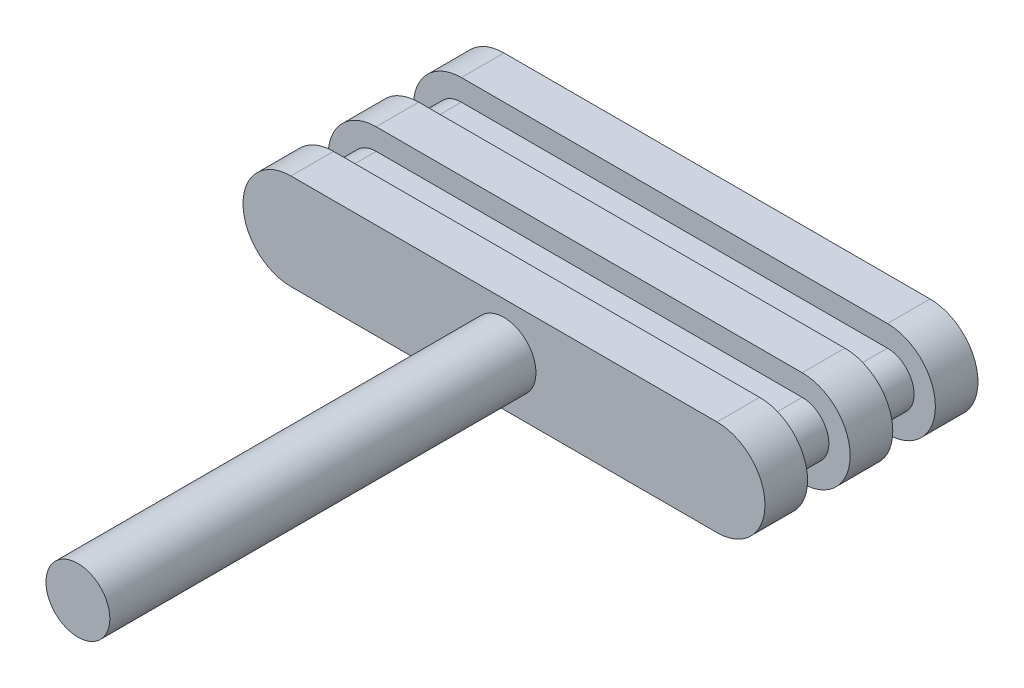
from build123d import *

# Parameters (mm, degrees)
BOSS_EXTRUDE1_DEPTH = 5
SKETCH4_R           = 1.5
BOSS_EXTRUDE3_DEPTH = 20
CUT_EXTRUDE2_START  = 2
CUT_EXTRUDE2_DEPTH  = 1
CUT_EXTRUDE4_START  = -2
CUT_EXTRUDE4_DEPTH  = 1


with BuildPart() as part:
    # Sketch1 → Boss-Extrude1 (new, symmetric)
    with BuildSketch(Plane.XY):
        with BuildLine():
            Line((10, 2.25), (-10, 2.25))
            ThreePointArc((-10, 2.25), (-12.25, 0), (-10, -2.25))
            Line((-10, -2.25), (10, -2.25))
            ThreePointArc((10, -2.25), (12.25, 0), (10, 2.25))
        make_face()
    extrude(amount=BOSS_EXTRUDE1_DEPTH, both=True)

    # Sketch4 → Boss-Extrude3 (add)
    with BuildSketch(Plane.XY.offset(5)):
        Circle(SKETCH4_R)
    extrude(amount=BOSS_EXTRUDE3_DEPTH)

    # Sketch1<4> → Cut-Extrude2 (cut, symmetric)
    with BuildSketch(Plane.XY.offset(CUT_EXTRUDE2_START)):
        with BuildLine():
            Line((0, 2.25), (-10, 2.25))
            ThreePointArc((-10, 2.25), (-12.25, 0), (-10, -2.25))
            Line((-10, -2.25), (0, -2.25))
            Line((0, -2.25), (10, -2.25))
            ThreePointArc((10, -2.25), (12.25, 0), (10, 2.25))
            Line((10, 2.25), (0, 2.25))
        make_face()
        with BuildLine():
            Line((0, 1.25), (-10, 1.25))
            ThreePointArc((-10, 1.25), (-11.25, 0), (-10, -1.25))
            Line((-10, -1.25), (0, -1.25))
            Line((0, -1.25), (10, -1.25))
            ThreePointArc((10, -1.25), (11.25, 0), (10, 1.25))
            Line((10, 1.25), (0, 1.25))
        make_face(mode=Mode.SUBTRACT)
    extrude(amount=CUT_EXTRUDE2_DEPTH, both=True, mode=Mode.SUBTRACT)

    # Sketch1<6> → Cut-Extrude4 (cut, symmetric)
    with BuildSketch(Plane.XY.offset(CUT_EXTRUDE4_START)):
        with BuildLine():
            Line((0, 2.25), (-10, 2.25))
            ThreePointArc((-10, 2.25), (-12.25, 0), (-10, -2.25))
            Line((-10, -2.25), (0, -2.25))
            Line((0, -2.25), (10, -2.25))
            ThreePointArc((10, -2.25), (12.25, 0), (10, 2.25))
            Line((10, 2.25), (0, 2.25))
        make_face()
        with BuildLine():
            Line((0, 1.25), (-10, 1.25))
            ThreePointArc((-10, 1.25), (-11.25, 0), (-10, -1.25))
            Line((-10, -1.25), (0, -1.25))
            Line((0, -1.25), (10, -1.25))
            ThreePointArc((10, -1.25), (11.25, 0), (10, 1.25))
            Line((10, 1.25), (0, 1.25))
        make_face(mode=Mode.SUBTRACT)
    extrude(amount=CUT_EXTRUDE4_DEPTH, both=True, mode=Mode.SUBTRACT)


solid = part.part
